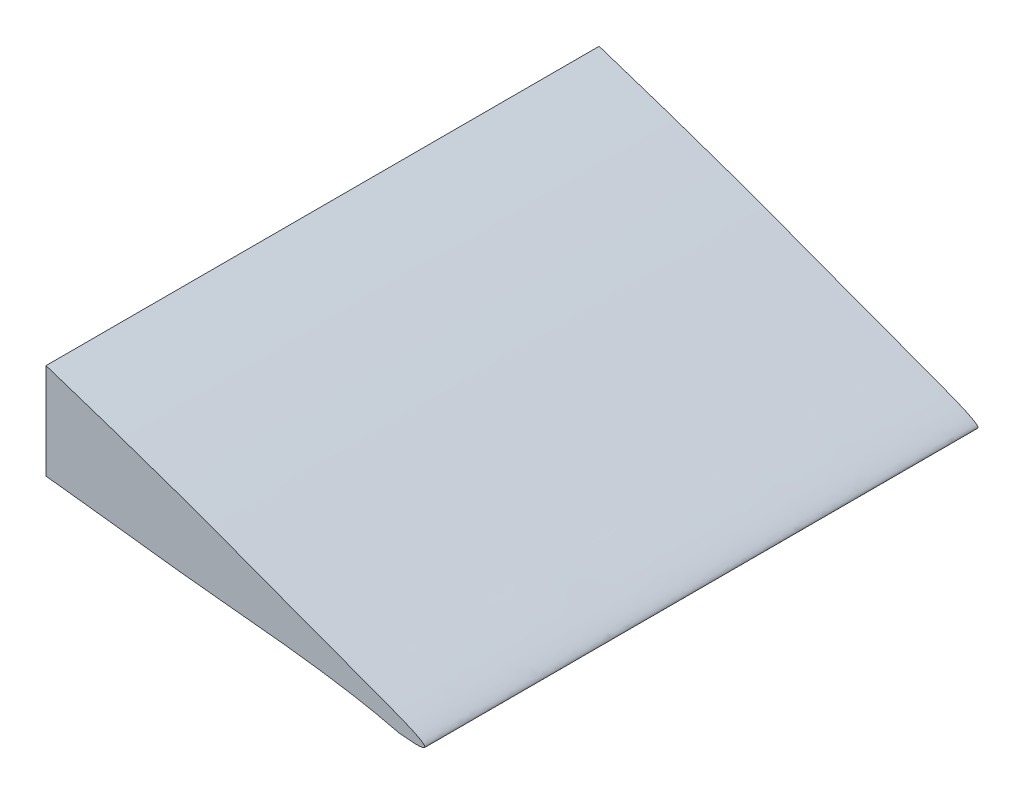
from build123d import *

# Parameters (mm, degrees)
BOSS_EXTRUDE1_DEPTH = 47.625
SKETCH2_R           = 6.35
SKETCH2_R_2         = 3.175
CUT_EXTRUDE1_DEPTH  = 320.299711675
SKETCH4_W           = 311.186636553
SKETCH4_H           = 117.489254048
CUT_EXTRUDE3_DEPTH  = 320.299711675


with BuildPart() as part:
    # Sketch1 → Boss-Extrude1 (new body)
    with BuildSketch(Plane.XY):
        with BuildLine():
            add(Edge.make_bspline(
                [(0.000560351, 0.000130087), (0.810633127, 7.359196055), (8.649092025, 17.856605174), (26.286719818, 29.975176328), (52.111128271, 42.069215275), (89.597618475, 49.290763054), (131.400792109, 47.884831915), (173.256699242, 40.041104278), (217.961060472, 29.612974894), (256.952064401, 19.528920948), (290.35983767, 8.71099439), (301.273197721, 4.382828139), (314.816918223, -0.516206742), (309.846313895, 0.000130087)],
                knots=[0, 0, 0, 0, 0.060863618, 0.113688265, 0.188608742, 0.312908923, 0.448482434, 0.557612135, 0.691544113, 0.852438279, 0.92975597, 0.976058229, 1, 1, 1, 1], degree=3))
            add(Edge.make_bspline(
                [(309.846313895, 0.000130087), (303.956832565, 1.47095521), (293.989507544, 2.093987313), (276.26402299, 4.514356704), (260.846344817, 5.427413394), (235.858814759, 7.870306192), (205.101424636, 8.838080282), (157.718638092, 9.030650149), (110.497331172, 6.181495223), (66.506197185, -0.586669107), (36.454672816, -6.098499901), (15.316603331, -6.189065841), (1.230714189, -6.924076091), (0.000560351, 0.000130087)],
                knots=[0, 0, 0, 0, 0.057787081, 0.095274891, 0.171021118, 0.205339302, 0.335319146, 0.464904334, 0.658702312, 0.785511947, 0.893517288, 0.94309214, 1, 1, 1, 1], degree=3))
        make_face()
    extrude(amount=BOSS_EXTRUDE1_DEPTH)

    # Sketch2 → Cut-Extrude1 (cut, through all)
    with BuildSketch(Plane.XY.offset(47.625)):
        with Locations((20.32, 10.16)):
            Circle(SKETCH2_R)
        with Locations((227.296313895, 19.050130087)):
            Circle(SKETCH2_R_2)
    extrude(amount=-CUT_EXTRUDE1_DEPTH, mode=Mode.SUBTRACT)

    # Sketch4 → Cut-Extrude3 (cut, through all)
    with BuildSketch(Plane.XY.offset(47.625)):
        with Locations((123.807242075, 34.528076629)):
            Rectangle(SKETCH4_W, SKETCH4_H)
    extrude(amount=-CUT_EXTRUDE3_DEPTH, mode=Mode.SUBTRACT)


solid = part.part
